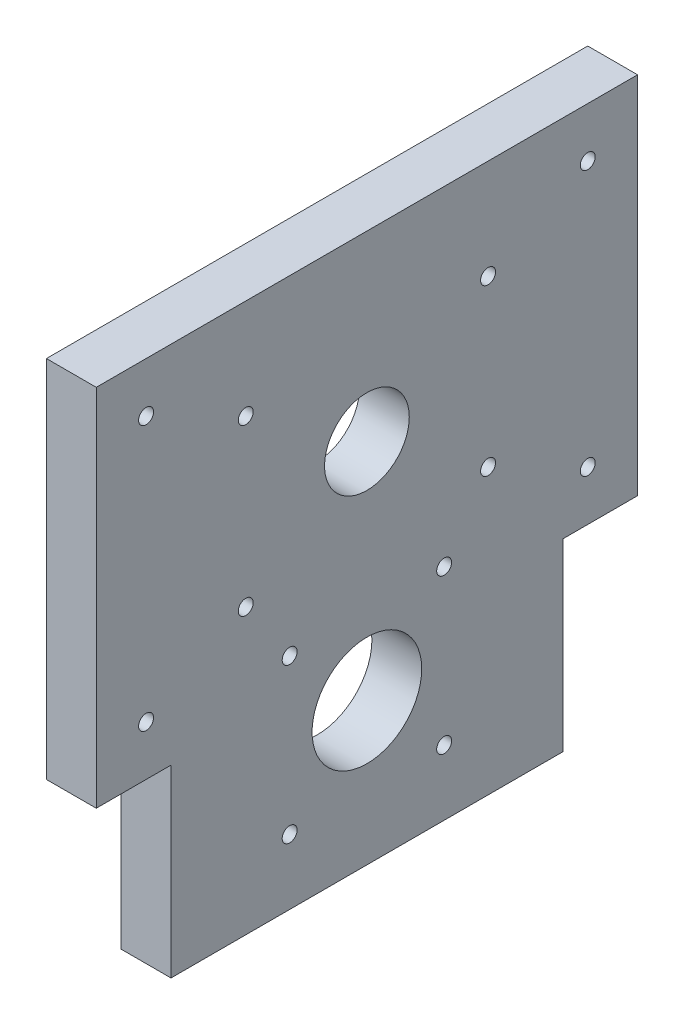
from build123d import *

# Parameters (mm, degrees)
SKETCH_1_R      = 1.5
SKETCH_1_R_2    = 8.5
SKETCH_1_R_3    = 11
EXTRUDE_1_DEPTH = 10


with BuildPart() as part:
    # 草图1 → 凸台-拉伸1 (new body)
    with BuildSketch(Plane(origin=(0, 0, 0), x_dir=(0, 0, -1), z_dir=(1, 0, 0))):
        Polygon((-27.5, 36.58), (-47.5, 36.58), (-47.5, -36.58), (-32.5, -36.58), (-32.5, -73.58), (46.13, -73.58), (46.13, -36.58), (61.13, -36.58), (61.13, 36.58), align=None)
        with Locations((-8.685, -29.5)):
            Circle(SKETCH_1_R, mode=Mode.SUBTRACT)
        with Locations((-37.5, 26.58)):
            Circle(SKETCH_1_R, mode=Mode.SUBTRACT)
        with Locations((-17.5, 16.58)):
            Circle(SKETCH_1_R, mode=Mode.SUBTRACT)
        with Locations((31.13, 16.58)):
            Circle(SKETCH_1_R, mode=Mode.SUBTRACT)
        with Locations((51.13, 26.58)):
            Circle(SKETCH_1_R, mode=Mode.SUBTRACT)
        with Locations((-37.5, -26.58)):
            Circle(SKETCH_1_R, mode=Mode.SUBTRACT)
        with Locations((-17.5, -16.58)):
            Circle(SKETCH_1_R, mode=Mode.SUBTRACT)
        with Locations((31.13, -16.58)):
            Circle(SKETCH_1_R, mode=Mode.SUBTRACT)
        with Locations((51.13, -26.58)):
            Circle(SKETCH_1_R, mode=Mode.SUBTRACT)
        with Locations((22.315, -29.5)):
            Circle(SKETCH_1_R, mode=Mode.SUBTRACT)
        with Locations((-8.685, -60.5)):
            Circle(SKETCH_1_R, mode=Mode.SUBTRACT)
        with Locations((22.315, -60.5)):
            Circle(SKETCH_1_R, mode=Mode.SUBTRACT)
        with Locations((6.815, 0)):
            Circle(SKETCH_1_R_2, mode=Mode.SUBTRACT)
        with Locations((6.815, -45)):
            Circle(SKETCH_1_R_3, mode=Mode.SUBTRACT)
    extrude(amount=EXTRUDE_1_DEPTH)


solid = part.part
